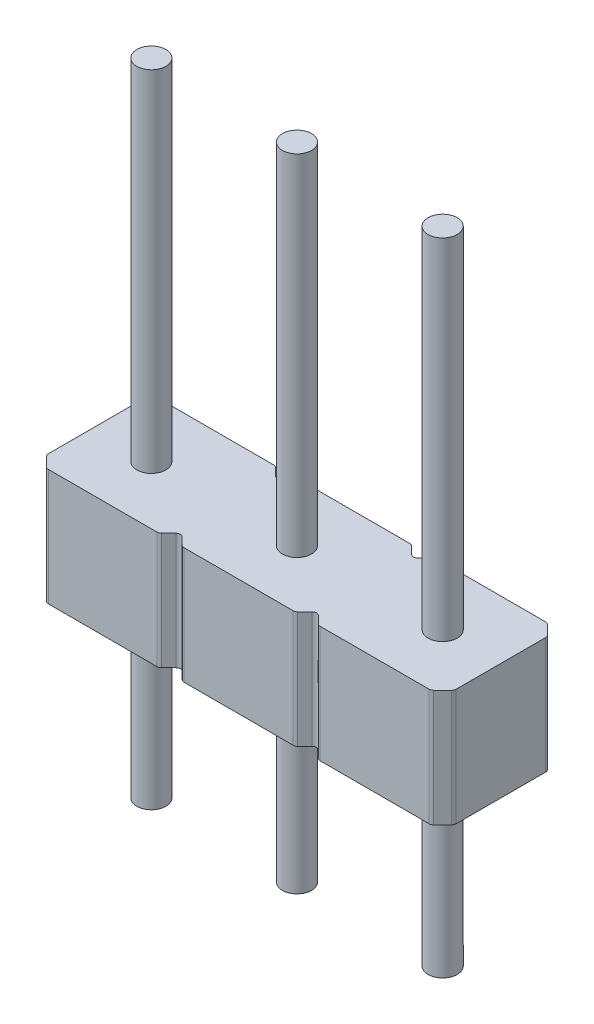
from build123d import *

# Parameters (mm, degrees)
IZIM1_R                          = 0.25
Y_KSEKLIK_EKSTR_ZYON1_DEPTH      = 2
Y_KSEKLIK_EKSTR_ZYON3_DEPTH      = 6
Y_KSEKLIK_EKSTR_ZYON3_DEPTH_BACK = 5
IZIM3_R                          = 0.25


with BuildPart() as part:
    # Çizim1 → Yükseklik-Ekstrüzyon1 (new body)
    with BuildSketch(Plane(origin=(0, 0, 0), x_dir=(1, 0, 0), z_dir=(0, 1, 0))):
        with BuildLine():
            Line((-3.477652227, 0.822347773), (-3.322347773, 0.977652227))
            ThreePointArc((-3.322347773, 0.977652227), (-3.297594249, 0.994192003), (-3.268395476, 1))
            Line((-3.268395476, 1), (-1.401604524, 1))
            ThreePointArc((-1.401604524, 1), (-1.372405751, 0.994192003), (-1.347652227, 0.977652227))
            Line((-1.347652227, 0.977652227), (-1.223952297, 0.853952297))
            ThreePointArc((-1.223952297, 0.853952297), (-1.17, 0.831604524), (-1.116047703, 0.853952297))
            Line((-1.116047703, 0.853952297), (-0.992347773, 0.977652227))
            ThreePointArc((-0.992347773, 0.977652227), (-0.967594249, 0.994192003), (-0.938395476, 1))
            Line((-0.938395476, 1), (0.935062143, 1))
            ThreePointArc((0.935062143, 1), (0.964260916, 0.994192003), (0.98901444, 0.977652227))
            Line((0.98901444, 0.977652227), (1.11271437, 0.853952297))
            ThreePointArc((1.11271437, 0.853952297), (1.166666667, 0.831604524), (1.220618963, 0.853952297))
            Line((1.220618963, 0.853952297), (1.344318894, 0.977652227))
            ThreePointArc((1.344318894, 0.977652227), (1.369072418, 0.994192003), (1.39827119, 1))
            Line((1.39827119, 1), (3.268395476, 1))
            ThreePointArc((3.268395476, 1), (3.297594249, 0.994192003), (3.322347773, 0.977652227))
            Line((3.322347773, 0.977652227), (3.477652227, 0.822347773))
            ThreePointArc((3.477652227, 0.822347773), (3.494192003, 0.797594249), (3.5, 0.768395476))
            Line((3.5, 0.768395476), (3.5, -0.768395476))
            ThreePointArc((3.5, -0.768395476), (3.494192003, -0.797594249), (3.477652227, -0.822347773))
            Line((3.477652227, -0.822347773), (3.322347773, -0.977652227))
            ThreePointArc((3.322347773, -0.977652227), (3.297594249, -0.994192003), (3.268395476, -1))
            Line((3.268395476, -1), (1.39827119, -1))
            ThreePointArc((1.39827119, -1), (1.369072418, -0.994192003), (1.344318894, -0.977652227))
            Line((1.344318894, -0.977652227), (1.220618963, -0.853952297))
            ThreePointArc((1.220618963, -0.853952297), (1.166666667, -0.831604524), (1.11271437, -0.853952297))
            Line((1.11271437, -0.853952297), (0.98901444, -0.977652227))
            ThreePointArc((0.98901444, -0.977652227), (0.964260916, -0.994192003), (0.935062143, -1))
            Line((0.935062143, -1), (-0.938395476, -1))
            ThreePointArc((-0.938395476, -1), (-0.967594249, -0.994192003), (-0.992347773, -0.977652227))
            Line((-0.992347773, -0.977652227), (-1.116047703, -0.853952297))
            ThreePointArc((-1.116047703, -0.853952297), (-1.17, -0.831604524), (-1.223952297, -0.853952297))
            Line((-1.223952297, -0.853952297), (-1.347652227, -0.977652227))
            ThreePointArc((-1.347652227, -0.977652227), (-1.372405751, -0.994192003), (-1.401604524, -1))
            Line((-1.401604524, -1), (-3.268395476, -1))
            ThreePointArc((-3.268395476, -1), (-3.297594249, -0.994192003), (-3.322347773, -0.977652227))
            Line((-3.322347773, -0.977652227), (-3.477652227, -0.822347773))
            ThreePointArc((-3.477652227, -0.822347773), (-3.494192003, -0.797594249), (-3.5, -0.768395476))
            Line((-3.5, -0.768395476), (-3.5, 0.768395476))
            ThreePointArc((-3.5, 0.768395476), (-3.494192003, 0.797594249), (-3.477652227, 0.822347773))
        make_face()
        with Locations(Location((0, 0, 0), (0, 0, 270))):
            Circle(IZIM1_R, mode=Mode.SUBTRACT)
        with Locations(Location((-2.5, 0, 0), (0, 0, 270))):
            Circle(IZIM1_R, mode=Mode.SUBTRACT)
        with Locations(Location((2.5, 0, 0), (0, 0, 270))):
            Circle(IZIM1_R, mode=Mode.SUBTRACT)
    extrude(amount=Y_KSEKLIK_EKSTR_ZYON1_DEPTH)

    # Çizim3 → Yükseklik-Ekstrüzyon3 (add, two sides: drawn at the far end of the back side and taken through both)
    with BuildSketch(Plane(origin=(0, 2, 0), x_dir=(1, 0, 0), z_dir=(0, 1, 0)).offset(-Y_KSEKLIK_EKSTR_ZYON3_DEPTH_BACK)):
        with Locations(Location((-2.5, 0, 0), (0, 0, 270))):
            Circle(IZIM3_R)
        with Locations(Location((0, 0, 0), (0, 0, 270))):
            Circle(IZIM3_R)
        with Locations(Location((2.5, 0, 0), (0, 0, 270))):
            Circle(IZIM3_R)
    extrude(amount=Y_KSEKLIK_EKSTR_ZYON3_DEPTH + Y_KSEKLIK_EKSTR_ZYON3_DEPTH_BACK)


solid = part.part
